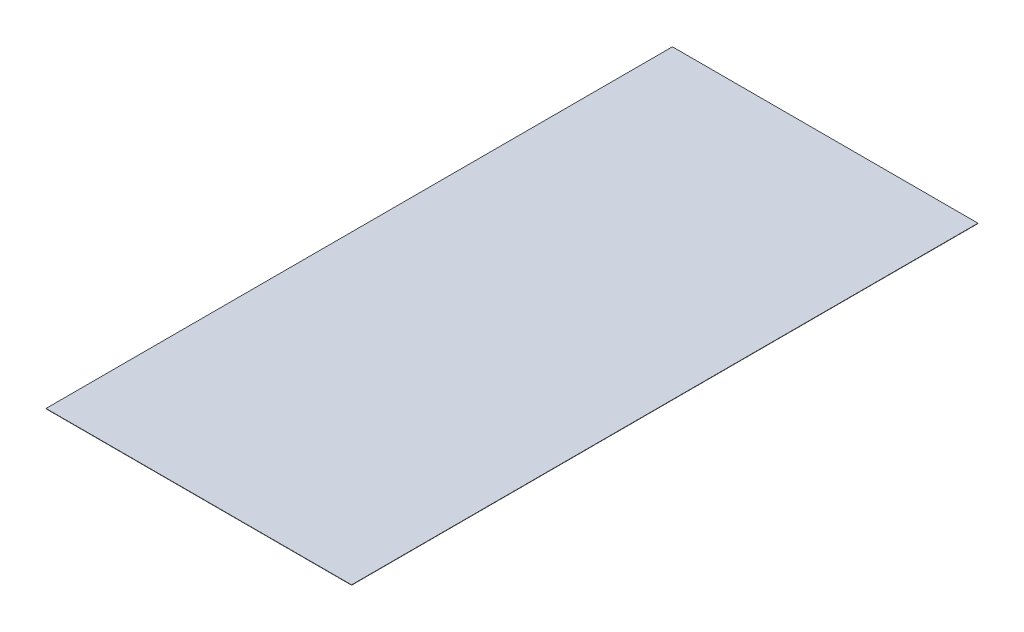
from build123d import *

# Parameters (mm, degrees)
SKETCH_1_W      = 1000
SKETCH_1_H      = 2050
EXTRUDE_1_DEPTH = 1


with BuildPart() as part:
    # Эскиз1 → Бобышка-Вытянуть1 (new body)
    with BuildSketch(Plane(origin=(0, 0, 0), x_dir=(1, 0, 0), z_dir=(0, 1, 0))):
        Rectangle(SKETCH_1_W, SKETCH_1_H)
    extrude(amount=EXTRUDE_1_DEPTH)


solid = part.part
